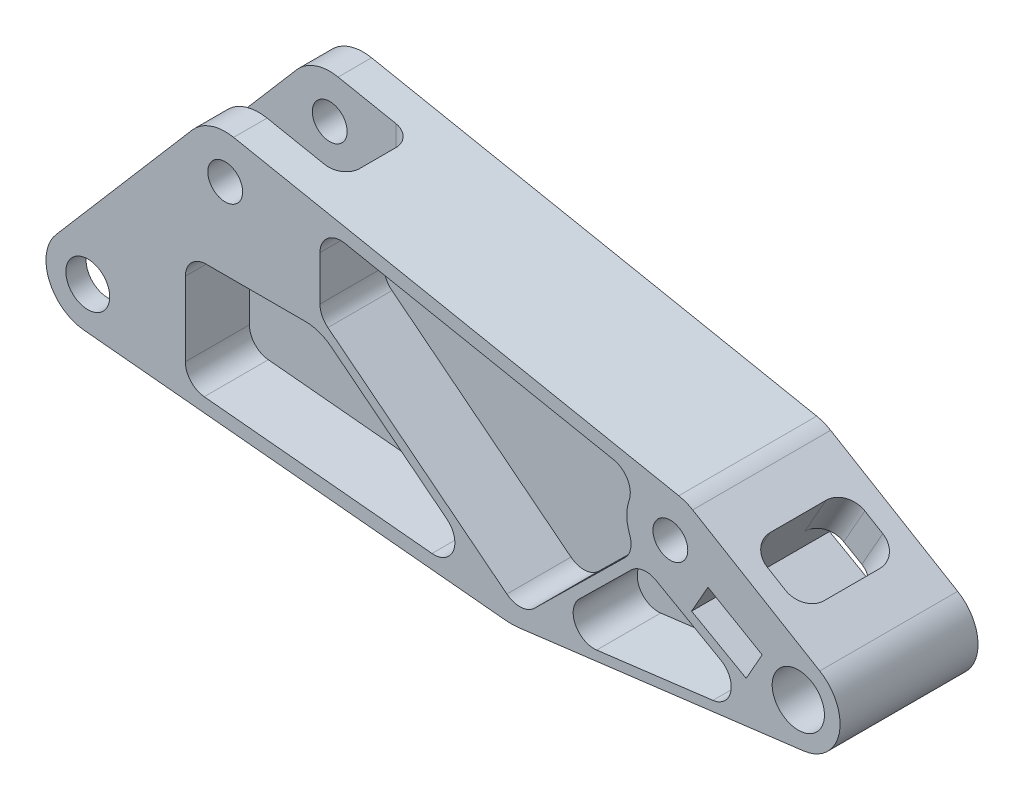
from build123d import *

# Parameters (mm, degrees)
SKETCH1_R           = 4.762499999999997
SKETCH1_R_2         = 3.17500000000001
SKETCH1_R_3         = 4.000000000000006
SKETCH1_R_4         = 3.174999999999997
BOSS_EXTRUDE1_DEPTH = 12.572999999999999
BOSS_EXTRUDE2_DEPTH = 0.889
SKETCH1_6_R         = 3.174999999999997
CUT_EXTRUDE1_DEPTH  = 6.477
SKETCH1_7_R         = 4.000000000000006
CUT_EXTRUDE2_DEPTH  = 8.889999999999999
CUT_EXTRUDE3_DEPTH  = 8.889999999999999
FILLET1_R           = 3.8099999999999996
FILLET2_R           = 3.175
FILLET3_R           = 12.7


with BuildPart() as part:
    # Sketch1 → Boss-Extrude1 (new, symmetric)
    with BuildSketch(Plane(origin=(0, 0, 0), x_dir=(0, 1, 0), z_dir=(0, 0, 1))):
        with BuildLine():
            ThreePointArc((20.382390084242772, 19.257386231100043), (20.978466310939545, 20.483226967362732), (21.356021010960387, 21.79297687753883))
            Line((21.356021010960387, 21.79297687753883), (37.358021010960385, 102.94546522066996))
            ThreePointArc((37.35802101096039, 102.94546522066996), (37.07094462485589, 107.07851604910101), (34.74047115882098, 110.5039233863327))
            Line((34.74047115882098, 110.5039233863327), (5.8316712608374885, 135.31904946315026))
            ThreePointArc((5.831671260837487, 135.31904946315026), (-1.9784012059195106, 136.6053065422467), (-6.71668575438994, 130.26493204642645))
            Line((-6.71668575438994, 130.26493204642645), (-14.21259444493871, 52.14693537573538))
            Line((-14.21259444493871, 52.14693537573538), (-7.56089550263359, -0.9472376672489283))
            ThreePointArc((-7.560895502633591, -0.9472376672489284), (-1.565846256947838, -7.457380605789306), (6.541359720008749, -3.9083261140093004))
            Line((6.541359720008749, -3.9083261140093004), (20.382390084242772, 19.257386231100043))
        make_face()
        Polygon((4.29827889322349, 19.45469368119458), (9.577469944104607, 16.46674342320252), (3.8313636145238874, 6.587343209590925), (-1.3308119334704958, 9.509064286128918), align=None, mode=Mode.SUBTRACT)
        with BuildLine():
            Line((-7.837469994075563, 15.563413639417114), (-10.493663341451699, 36.76527356188965))
            ThreePointArc((-10.493663341451697, 36.76527356188965), (-8.373880180823447, 40.66792915781828), (-3.9976174727208837, 39.91127464075849))
            Line((-3.9976174727208846, 39.91127464075849), (5.307057429865875, 30.45613112841883))
            ThreePointArc((5.307057429865875, 30.45613112841883), (6.368728770469758, 28.282081544681937), (5.907210919033615, 25.907078618197012))
            Line((5.907210919033615, 25.907078618197012), (-0.7412706361770095, 14.160362208064143))
            ThreePointArc((-0.7412706361770094, 14.160362208064143), (-4.796024243086445, 12.29938935959272), (-7.837469994075564, 15.563413639417115))
        make_face(mode=Mode.SUBTRACT)
        Circle(SKETCH1_R, mode=Mode.SUBTRACT)
        with BuildLine():
            Line((-9.835366262341573, 53.13228955360719), (15.923267523608242, 85.75989234914361))
            ThreePointArc((15.92326752360824, 85.75989234914361), (17.2521532494062, 86.82767112773601), (18.9136708602906, 87.20904760965752))
            Line((18.9136708602906, 87.20904760965752), (27.031501436121193, 87.20904760965755))
            ThreePointArc((27.031501436121193, 87.20904760965755), (29.974660714259272, 85.81853380790496), (30.769524140950022, 82.6619680629435))
            Line((30.769524140950015, 82.6619680629435), (21.11582108508837, 33.70421123824264))
            ThreePointArc((21.11582108508837, 33.70421123824264), (19.28061275870069, 31.140473092142116), (16.142341730197096, 30.837161643844155))
            ThreePointArc((16.142341730197096, 30.837161643844155), (13.427097985028178, 31.264800137027077), (10.728808005125181, 30.74072527511728))
            ThreePointArc((10.728808005125181, 30.74072527511728), (8.557460112178255, 30.57529521299933), (6.650170349739085, 31.62618271399653))
            Line((6.650170349739083, 31.62618271399653), (-9.560561043073251, 48.099062568876725))
            ThreePointArc((-9.56056104307325, 48.099062568876725), (-10.649296851393418, 50.56373496479325), (-9.835366262341573, 53.13228955360719))
        make_face(mode=Mode.SUBTRACT)
        with Locations((13.568473709233661, 23.328559266526405)):
            Circle(SKETCH1_R_2, mode=Mode.SUBTRACT)
        with BuildLine():
            ThreePointArc((-6.271634521139667, 108.31101038198426), (-5.0412373021941335, 110.76689735834775), (-2.4790547893278805, 111.75708871754208))
            Line((-2.4790547893278805, 111.75708871754208), (11.028473709233646, 111.75708871754206))
            ThreePointArc((11.028473709233646, 111.75708871754206), (13.722550545554382, 110.6411655538628), (14.838473709233643, 107.94708871754207))
            Line((14.838473709233645, 107.94708871754207), (14.838473709233652, 89.90058630028007))
            ThreePointArc((14.83847370923365, 89.90058630028007), (14.417020328206092, 87.40152116017657), (13.199280382598367, 85.17889682130792))
            Line((13.199280382598367, 85.17889682130792), (-3.473328559543596, 64.06025882792814))
            ThreePointArc((-3.473328559543596, 64.06025882792814), (-7.883928971008091, 62.885691247927234), (-10.256311628037745, 66.7850252318564))
            Line((-10.256311628037743, 66.7850252318564), (-6.271634521139673, 108.31101038198426))
        make_face(mode=Mode.SUBTRACT)
        with Locations((0.868473709233646, 129.5370887175421)):
            Circle(SKETCH1_R_3, mode=Mode.SUBTRACT)
        with Locations((29.57047370923365, 104.48104760965752)):
            Circle(SKETCH1_R_4, mode=Mode.SUBTRACT)
    extrude(amount=BOSS_EXTRUDE1_DEPTH, both=True)

    # Sketch1<5> → Boss-Extrude2 (add, symmetric)
    with BuildSketch(Plane(origin=(0, 0, 0), x_dir=(0, 1, 0), z_dir=(0, 0, 1))):
        with BuildLine():
            Line((11.028473709233646, 111.75708871754206), (-2.4790547893278805, 111.75708871754208))
            ThreePointArc((-2.4790547893278805, 111.75708871754208), (-5.0412373021941335, 110.76689735834775), (-6.271634521139667, 108.31101038198426))
            Line((-6.271634521139673, 108.31101038198426), (-10.256311628037743, 66.7850252318564))
            ThreePointArc((-10.256311628037745, 66.7850252318564), (-7.883928971008091, 62.885691247927234), (-3.473328559543596, 64.06025882792814))
            Line((-3.473328559543596, 64.06025882792814), (13.199280382598367, 85.17889682130792))
            ThreePointArc((13.199280382598367, 85.17889682130792), (14.417020328206092, 87.40152116017657), (14.83847370923365, 89.90058630028007))
            Line((14.838473709233652, 89.90058630028007), (14.838473709233645, 107.94708871754207))
            ThreePointArc((14.838473709233643, 107.94708871754207), (13.722550545554382, 110.6411655538628), (11.028473709233646, 111.75708871754206))
        make_face()
        with BuildLine():
            ThreePointArc((18.9136708602906, 87.20904760965752), (17.2521532494062, 86.82767112773601), (15.92326752360824, 85.75989234914361))
            Line((15.923267523608242, 85.75989234914361), (-9.835366262341573, 53.13228955360719))
            ThreePointArc((-9.835366262341573, 53.13228955360719), (-10.649296851393418, 50.56373496479325), (-9.56056104307325, 48.099062568876725))
            Line((-9.560561043073251, 48.099062568876725), (6.650170349739083, 31.62618271399653))
            ThreePointArc((6.650170349739085, 31.62618271399653), (8.557460112178255, 30.57529521299933), (10.728808005125181, 30.74072527511728))
            ThreePointArc((10.728808005125181, 30.74072527511728), (13.427097985028178, 31.264800137027077), (16.142341730197096, 30.837161643844155))
            ThreePointArc((16.142341730197096, 30.837161643844155), (19.28061275870069, 31.140473092142116), (21.11582108508837, 33.70421123824264))
            Line((21.11582108508837, 33.70421123824264), (30.769524140950015, 82.6619680629435))
            ThreePointArc((30.769524140950022, 82.6619680629435), (29.974660714259272, 85.81853380790496), (27.031501436121193, 87.20904760965755))
            Line((27.031501436121193, 87.20904760965755), (18.9136708602906, 87.20904760965752))
        make_face()
        with BuildLine():
            ThreePointArc((-3.9976174727208837, 39.91127464075849), (-8.373880180823447, 40.66792915781828), (-10.493663341451697, 36.76527356188965))
            Line((-10.493663341451699, 36.76527356188965), (-7.837469994075563, 15.563413639417114))
            ThreePointArc((-7.837469994075564, 15.563413639417115), (-4.796024243086445, 12.29938935959272), (-0.7412706361770094, 14.160362208064143))
            Line((-0.7412706361770095, 14.160362208064143), (5.907210919033615, 25.907078618197012))
            ThreePointArc((5.907210919033615, 25.907078618197012), (6.368728770469758, 28.282081544681937), (5.307057429865875, 30.45613112841883))
            Line((5.307057429865875, 30.45613112841883), (-3.9976174727208846, 39.91127464075849))
        make_face()
    extrude(amount=BOSS_EXTRUDE2_DEPTH, both=True)

    # Sketch1<6> → Cut-Extrude1 (cut, symmetric)
    with BuildSketch(Plane(origin=(0, 0, 0), x_dir=(0, 1, 0), z_dir=(0, 0, 1))):
        with BuildLine():
            Line((16.870473709233643, 89.24104760965754), (34.65572444447459, 89.24104760965754))
            Line((34.6557244444746, 89.24104760965753), (37.358021010960385, 102.94546522066996))
            ThreePointArc((37.35802101096039, 102.94546522066996), (37.07094462485589, 107.07851604910101), (34.74047115882098, 110.5039233863327))
            Line((34.74047115882098, 110.5039233863327), (16.870473709233643, 125.84341313577922))
            Line((16.870473709233647, 125.84341313577922), (16.870473709233643, 89.24104760965754))
        make_face()
        with Locations((29.57047370923365, 104.48104760965752)):
            Circle(SKETCH1_6_R, mode=Mode.SUBTRACT)
    extrude(amount=CUT_EXTRUDE1_DEPTH, both=True, mode=Mode.SUBTRACT)

    # Sketch1<7> → Cut-Extrude2 (cut, symmetric)
    with BuildSketch(Plane(origin=(0, 0, 0), x_dir=(0, 1, 0), z_dir=(0, 0, 1))):
        with BuildLine():
            Line((14.838473709233647, 114.29708871754207), (14.838473709233648, 127.58766873843433))
            Line((14.83847370923364, 127.58766873843433), (5.831671260837486, 135.31904946315026))
            ThreePointArc((5.831671260837487, 135.31904946315026), (-1.9784012059195106, 136.6053065422467), (-6.71668575438994, 130.26493204642645))
            Line((-6.71668575438994, 130.26493204642645), (-8.248899849470712, 114.29708871754207))
            Line((-8.24889984947071, 114.29708871754207), (14.838473709233647, 114.29708871754207))
        make_face()
        with Locations((0.868473709233646, 129.5370887175421)):
            Circle(SKETCH1_7_R, mode=Mode.SUBTRACT)
    extrude(amount=CUT_EXTRUDE2_DEPTH, both=True, mode=Mode.SUBTRACT)

    # Sketch1<9> → Cut-Extrude3 (cut, symmetric)
    with BuildSketch(Plane(origin=(0, 0, 0), x_dir=(0, 1, 0), z_dir=(0, 0, 1))):
        Polygon((10.542747734850291, 2.7887911737698072), (16.405901968121537, 12.601943867513532), (9.577469944104607, 16.46674342320252), (3.8313636145238874, 6.587343209590925), align=None)
    extrude(amount=CUT_EXTRUDE3_DEPTH, both=True, mode=Mode.SUBTRACT)

    # Fillet1
    fillet1_edges = [part.edges().sort_by_distance(p)[0] for p in [
        (-120.9423787279882, 14.838473709233647, 8.889999999999999),
        (-120.9423787279882, 14.838473709233647, -8.889999999999999),
        (-107.54223037271838, 16.870473709233643, 6.477),
        (-107.54223037271838, 16.870473709233643, -6.477),
        (-4.688067191680366, 7.1870556746870875, -8.889999999999999),
        (-14.534343645358025, 12.99168595611307, -8.889999999999999),
        (-14.534343645358025, 12.99168595611307, 8.889999999999999),
        (-4.688067191680366, 7.1870556746870875, 8.889999999999999),
    ]]
    fillet(fillet1_edges, radius=FILLET1_R)

    # Fillet2
    fillet2_edges = [part.edges().sort_by_distance(p)[0] for p in [
        (-89.24104760965754, 27.66809907685412, -6.477),
        (-89.24104760965754, 17.986396872912895, -5.3610768363207475),
        (-89.24104760965754, 27.66809907685412, 6.477),
        (-89.24104760965754, 17.986396872912895, 5.3610768363207475),
        (-89.24104760965754, 16.870473709233643, 0),
        (-114.29708871754207, 1.3897869298814687, -8.889999999999999),
        (-114.29708871754207, 13.722550545554395, -7.774076836320745),
        (-114.29708871754207, 1.3897869298814687, 8.889999999999999),
        (-114.29708871754207, 13.722550545554393, 7.774076836320746),
        (-114.29708871754207, 14.838473709233647, 0),
    ]]
    fillet(fillet2_edges, radius=FILLET2_R)

    # Fillet3
    fillet3_edges = [part.edges().sort_by_distance(p)[0] for p in [
        (-52.14693537573538, -14.21259444493871, 0),
    ]]
    fillet(fillet3_edges, radius=FILLET3_R)


solid = part.part
